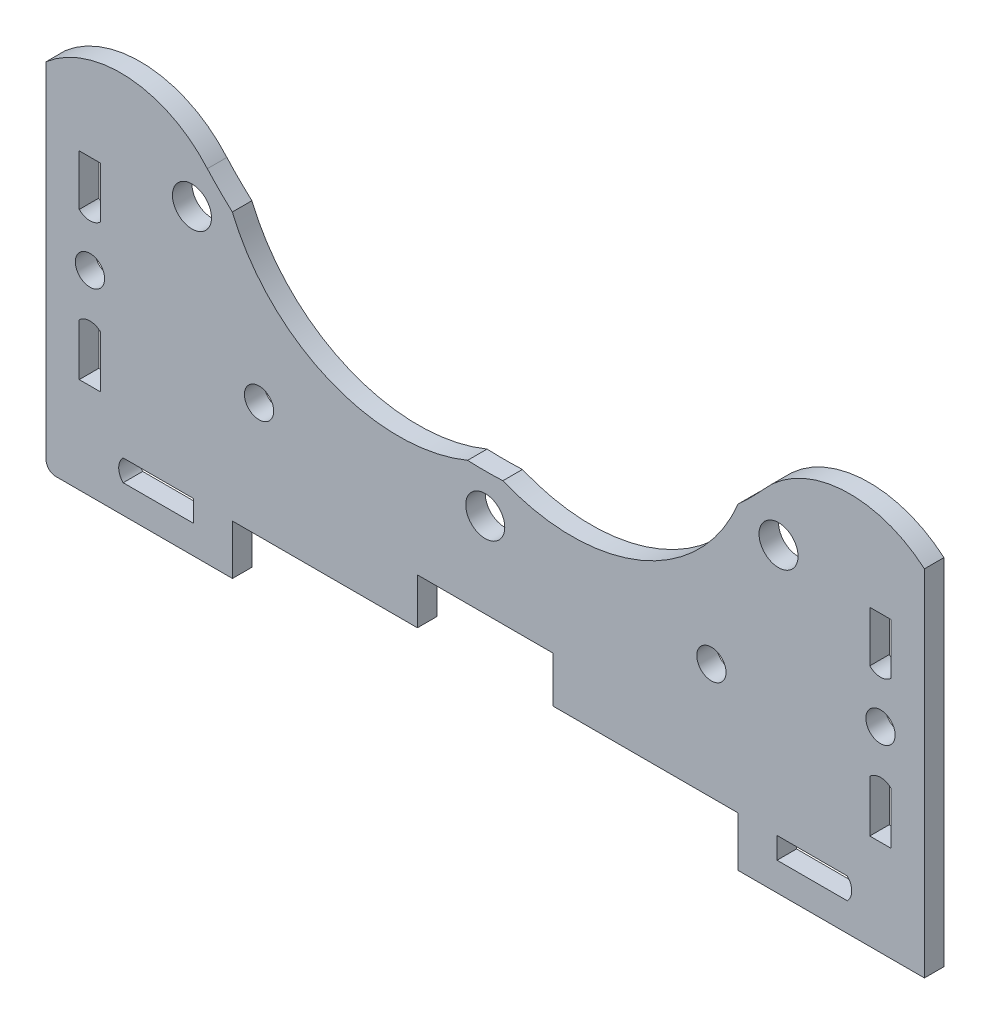
from build123d import *

# Parameters (mm, degrees)
SKETCH_3_R      = 2
SKETCH_3_R_2    = 1.999999997
SKETCH_3_R_3    = 1.999999995
SKETCH_3_R_4    = 1.5
EXTRUDE_1_DEPTH = 2


with BuildPart() as part:
    # 草图3 → 凸台-拉伸1 (new body)
    with BuildSketch(Plane.XY):
        with BuildLine():
            Line((-25.9, -3.990216685), (-25.9, 0.109783315))
            Line((-25.9, 0.109783315), (-15.9, 0.109783315))
            Line((-15.9, 0.109783315), (-6.948981504, 0.109783315))
            Line((-6.948981504, 0.109783315), (-6.948981504, 4.809783315))
            Line((-6.948981504, 4.809783315), (6.948981504, 4.809783315))
            Line((6.948981504, 4.809783315), (6.948981504, 0.109783315))
            Line((6.948981504, 0.109783315), (15.9, 0.109783315))
            Line((15.9, 0.109783315), (25.9, 0.109783315))
            Line((25.9, 0.109783315), (25.9, -3.990216685))
            Line((25.9, -3.990216685), (25.9, -4.990216685))
            Line((25.9, -4.990216685), (45, -4.990216685))
            Line((45, -4.990216685), (45, -3.990216685))
            Line((45, -3.990216685), (45, 8.890084071))
            Line((45, 8.890084071), (45, 21.128606731))
            Line((45, 21.128606731), (45, 31.317051182))
            ThreePointArc((45, 31.317051182), (36.482419799, 34.124770496), (28.474223712, 30.087289143))
            ThreePointArc((28.474223712, 30.087289143), (27.223611076, 28.776388924), (25.912710857, 27.525776288))
            ThreePointArc((25.912710857, 27.525776288), (15.928828372, 17.542283516), (1.809761925, 17.542559084))
            ThreePointArc((1.809761925, 17.542559084), (0, 17.5), (-1.809761925, 17.542559084))
            ThreePointArc((-1.809761925, 17.542559084), (-15.928828372, 17.542283516), (-25.912710857, 27.525776288))
            ThreePointArc((-25.912710857, 27.525776288), (-27.223611076, 28.776388924), (-28.474223712, 30.087289143))
            ThreePointArc((-28.474223712, 30.087289143), (-36.482419799, 34.124770496), (-45, 31.317051182))
            Line((-45, 31.317051182), (-45, 21.128606731))
            Line((-45, 21.128606731), (-45, 8.890084071))
            Line((-45, 8.890084071), (-45, -3.990216685))
            ThreePointArc((-45, -3.990216685), (-44.707106781, -4.697323466), (-44, -4.990216685))
            Line((-44, -4.990216685), (-25.9, -4.990216685))
            Line((-25.9, -4.990216685), (-25.9, -3.990216685))
        make_face()
        with Locations((0, 13.5)):
            Circle(SKETCH_3_R, mode=Mode.SUBTRACT)
        with Locations((-30.0520382, 25.94796181)):
            Circle(SKETCH_3_R_2, mode=Mode.SUBTRACT)
        with Locations((30.052038207, 25.947961792)):
            Circle(SKETCH_3_R_3, mode=Mode.SUBTRACT)
        with Locations((-23.174490752, 11.959783315)):
            Circle(SKETCH_3_R_4, mode=Mode.SUBTRACT)
        with Locations(Location((23.174490752, 11.959783315, 0), (0, 0, 180))):
            Circle(SKETCH_3_R_4, mode=Mode.SUBTRACT)
        with Locations((40.5, 15.059783315)):
            Circle(SKETCH_3_R_4, mode=Mode.SUBTRACT)
        with Locations(Location((-40.5, 15.059783315, 0), (0, 0, 180))):
            Circle(SKETCH_3_R_4, mode=Mode.SUBTRACT)
        with BuildLine():
            Line((-37.1, -2.090216685), (-29.9, -2.090216685))
            Line((-29.9, -2.090216685), (-29.9, 0.109783315))
            Line((-29.9, 0.109783315), (-37.1, 0.109783315))
            ThreePointArc((-37.1, 0.109783315), (-37.555634919, -0.990216685), (-37.1, -2.090216685))
        make_face(mode=Mode.SUBTRACT)
        with BuildLine():
            Line((-41.6, 25.109783315), (-39.4, 25.109783315))
            Line((-39.4, 25.109783315), (-39.4, 19.909783315))
            ThreePointArc((-39.4, 19.909783315), (-40.5, 19.454148396), (-41.6, 19.909783315))
            Line((-41.6, 19.909783315), (-41.6, 25.109783315))
        make_face(mode=Mode.SUBTRACT)
        with BuildLine():
            Line((-39.4, 10.109783315), (-39.4, 4.809783315))
            Line((-39.4, 4.809783315), (-41.6, 4.809783315))
            Line((-41.6, 4.809783315), (-41.6, 10.109783315))
            ThreePointArc((-41.6, 10.109783315), (-40.5, 10.565418233), (-39.4, 10.109783315))
        make_face(mode=Mode.SUBTRACT)
        with BuildLine():
            Line((37.1, 0.109783315), (29.9, 0.109783315))
            Line((29.9, 0.109783315), (29.9, -2.090216685))
            Line((29.9, -2.090216685), (37.1, -2.090216685))
            ThreePointArc((37.1, -2.090216685), (37.555634919, -0.990216685), (37.1, 0.109783315))
        make_face(mode=Mode.SUBTRACT)
        with BuildLine():
            Line((41.6, 4.809783315), (41.6, 10.109783315))
            ThreePointArc((41.6, 10.109783315), (40.5, 10.565418233), (39.4, 10.109783315))
            Line((39.4, 10.109783315), (39.4, 4.809783315))
            Line((39.4, 4.809783315), (41.6, 4.809783315))
        make_face(mode=Mode.SUBTRACT)
        with BuildLine():
            Line((39.4, 25.109783315), (39.4, 19.909783315))
            ThreePointArc((39.4, 19.909783315), (40.5, 19.454148396), (41.6, 19.909783315))
            Line((41.6, 19.909783315), (41.6, 25.109783315))
            Line((41.6, 25.109783315), (39.4, 25.109783315))
        make_face(mode=Mode.SUBTRACT)
    extrude(amount=EXTRUDE_1_DEPTH)


solid = part.part
